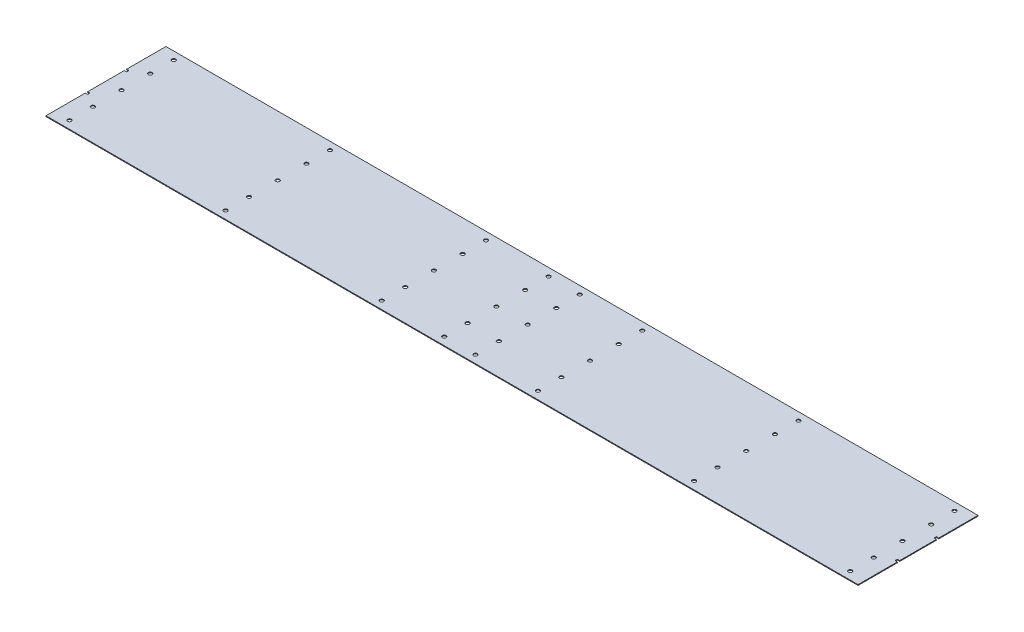
from build123d import *

# Parameters (mm, degrees)
SKETCH1_R           = 2.4
BOSS_EXTRUDE1_DEPTH = 1


with BuildPart() as part:
    # Sketch1 → Boss-Extrude1 (new body)
    with BuildSketch(Plane(origin=(0, 0, 0), x_dir=(1, 0, 0), z_dir=(0, 1, 0))):
        Polygon((-20, -26.5), (-20, -76.8), (1020, -76.8), (1020, -26.5), (1017, -26.5), (1017, -23.5), (1020, -23.5), (1020, 23.5), (1017, 23.5), (1017, 26.5), (1020, 26.5), (1020, 76.8), (-20, 76.8), (-20, 26.5), (-17, 26.5), (-17, 23.5), (-20, 23.5), (-20, -23.5), (-17, -23.5), (-17, -26.5), align=None)
        with Locations(Location((0, -36.8, 0), (0, 0, 270))):
            Circle(SKETCH1_R, mode=Mode.SUBTRACT)
        with Locations(Location((0, 36.8, 0), (0, 0, 270))):
            Circle(SKETCH1_R, mode=Mode.SUBTRACT)
        with Locations(Location((0, -66.8, 0), (0, 0, 270))):
            Circle(SKETCH1_R, mode=Mode.SUBTRACT)
        with Locations(Location((0, 66.8, 0), (0, 0, 270))):
            Circle(SKETCH1_R, mode=Mode.SUBTRACT)
        with Locations(Location((200, -66.8, 0), (0, 0, 270))):
            Circle(SKETCH1_R, mode=Mode.SUBTRACT)
        with Locations(Location((200, -36.8, 0), (0, 0, 270))):
            Circle(SKETCH1_R, mode=Mode.SUBTRACT)
        with Locations(Location((200, 36.8, 0), (0, 0, 270))):
            Circle(SKETCH1_R, mode=Mode.SUBTRACT)
        with Locations(Location((200, 66.8, 0), (0, 0, 270))):
            Circle(SKETCH1_R, mode=Mode.SUBTRACT)
        with Locations(Location((0, 0, 0), (0, 0, 270))):
            Circle(SKETCH1_R, mode=Mode.SUBTRACT)
        with Locations(Location((480, 0, 0), (0, 0, 270))):
            Circle(SKETCH1_R, mode=Mode.SUBTRACT)
        with Locations(Location((200, 0, 0), (0, 0, 270))):
            Circle(SKETCH1_R, mode=Mode.SUBTRACT)
        with Locations(Location((480, 66.8, 0), (0, 0, 270))):
            Circle(SKETCH1_R, mode=Mode.SUBTRACT)
        with Locations(Location((480, 36.8, 0), (0, 0, 270))):
            Circle(SKETCH1_R, mode=Mode.SUBTRACT)
        with Locations(Location((480, -36.8, 0), (0, 0, 270))):
            Circle(SKETCH1_R, mode=Mode.SUBTRACT)
        with Locations(Location((480, -66.8, 0), (0, 0, 270))):
            Circle(SKETCH1_R, mode=Mode.SUBTRACT)
        with Locations(Location((400, -66.8, 0), (0, 0, 270))):
            Circle(SKETCH1_R, mode=Mode.SUBTRACT)
        with Locations(Location((400, -36.8, 0), (0, 0, 270))):
            Circle(SKETCH1_R, mode=Mode.SUBTRACT)
        with Locations(Location((400, 36.8, 0), (0, 0, 270))):
            Circle(SKETCH1_R, mode=Mode.SUBTRACT)
        with Locations(Location((400, 66.8, 0), (0, 0, 270))):
            Circle(SKETCH1_R, mode=Mode.SUBTRACT)
        with Locations(Location((600, -66.8, 0), (0, 0, 270))):
            Circle(SKETCH1_R, mode=Mode.SUBTRACT)
        with Locations(Location((600, -36.8, 0), (0, 0, 270))):
            Circle(SKETCH1_R, mode=Mode.SUBTRACT)
        with Locations(Location((600, 36.8, 0), (0, 0, 270))):
            Circle(SKETCH1_R, mode=Mode.SUBTRACT)
        with Locations(Location((600, 66.8, 0), (0, 0, 270))):
            Circle(SKETCH1_R, mode=Mode.SUBTRACT)
        with Locations(Location((800, -66.8, 0), (0, 0, 270))):
            Circle(SKETCH1_R, mode=Mode.SUBTRACT)
        with Locations(Location((800, -36.8, 0), (0, 0, 270))):
            Circle(SKETCH1_R, mode=Mode.SUBTRACT)
        with Locations(Location((800, 36.8, 0), (0, 0, 270))):
            Circle(SKETCH1_R, mode=Mode.SUBTRACT)
        with Locations(Location((800, 66.8, 0), (0, 0, 270))):
            Circle(SKETCH1_R, mode=Mode.SUBTRACT)
        with Locations(Location((1000, -66.8, 0), (0, 0, 270))):
            Circle(SKETCH1_R, mode=Mode.SUBTRACT)
        with Locations(Location((1000, -36.8, 0), (0, 0, 270))):
            Circle(SKETCH1_R, mode=Mode.SUBTRACT)
        with Locations(Location((1000, 36.8, 0), (0, 0, 270))):
            Circle(SKETCH1_R, mode=Mode.SUBTRACT)
        with Locations(Location((1000, 66.8, 0), (0, 0, 270))):
            Circle(SKETCH1_R, mode=Mode.SUBTRACT)
        with Locations(Location((520, -66.8, 0), (0, 0, 270))):
            Circle(SKETCH1_R, mode=Mode.SUBTRACT)
        with Locations(Location((520, -36.8, 0), (0, 0, 270))):
            Circle(SKETCH1_R, mode=Mode.SUBTRACT)
        with Locations(Location((520, 0, 0), (0, 0, 270))):
            Circle(SKETCH1_R, mode=Mode.SUBTRACT)
        with Locations(Location((520, 36.8, 0), (0, 0, 270))):
            Circle(SKETCH1_R, mode=Mode.SUBTRACT)
        with Locations(Location((520, 66.8, 0), (0, 0, 270))):
            Circle(SKETCH1_R, mode=Mode.SUBTRACT)
        with Locations(Location((600, 0, 0), (0, 0, 270))):
            Circle(SKETCH1_R, mode=Mode.SUBTRACT)
        with Locations(Location((800, 0, 0), (0, 0, 270))):
            Circle(SKETCH1_R, mode=Mode.SUBTRACT)
        with Locations(Location((1000, 0, 0), (0, 0, 270))):
            Circle(SKETCH1_R, mode=Mode.SUBTRACT)
        with Locations(Location((400, 0, 0), (0, 0, 270))):
            Circle(SKETCH1_R, mode=Mode.SUBTRACT)
    extrude(amount=BOSS_EXTRUDE1_DEPTH)


solid = part.part
